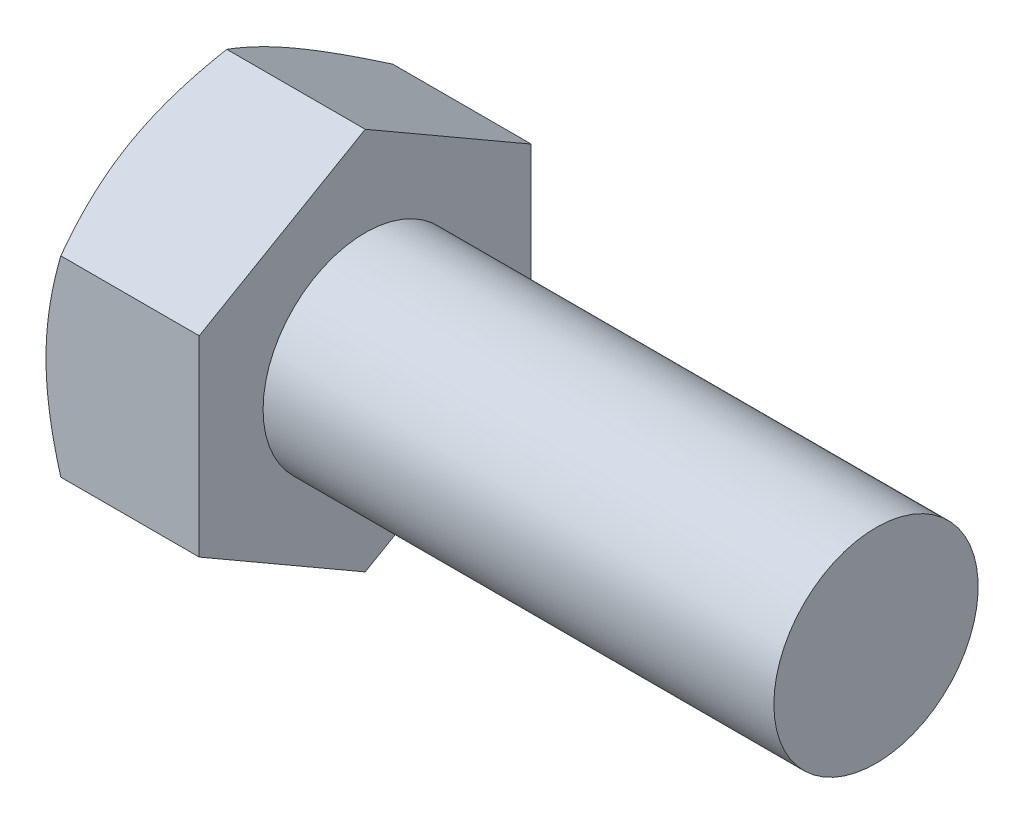
from build123d import *

# Parameters (mm, degrees)
HEX_DIE_START = -1e-06
SKETCH2_R     = 7.580831409
HEX_DIE_DEPTH = 6.000001
SKETCH4_R     = 5.6875
INDENT_DEPTH  = 0.75


with BuildPart() as part:
    # BodySke → Base-Revolve (revolve)
    with BuildSketch(Plane.XY, mode=Mode.PRIVATE) as base_revolve_sk:
        Polygon((6, 4), (6, 7.505773672), (0.5806837, 7.505773672), (0, 6.5), (0, 0), (26, 0), (26, 4), align=None)
    revolve(base_revolve_sk.sketch.rotate(Axis((-25.4, 0, 0), (1, 0, 0)), 90), axis=Axis((-25.4, 0, 0), (1, 0, 0)))

    # Sketch2 → Hex-Die (cut)
    with BuildSketch(Plane(origin=(0, 0, 0), x_dir=(0, 0, -1), z_dir=(1, 0, 0)).offset(HEX_DIE_START)):
        Circle(SKETCH2_R)
        Polygon((-6.5, 3.752776766), (0, 7.505553532), (6.5, 3.752776766), (6.5, -3.752776766), (0, -7.505553532), (-6.5, -3.752776766), align=None, mode=Mode.SUBTRACT)
    extrude(amount=HEX_DIE_DEPTH, mode=Mode.SUBTRACT)

    # Sketch4 → Indent (cut)
    with BuildSketch(Plane(origin=(0, 0, 0), x_dir=(0, 0, -1), z_dir=(1, 0, 0))):
        Circle(SKETCH4_R)
    extrude(amount=INDENT_DEPTH, mode=Mode.SUBTRACT)


solid = part.part
